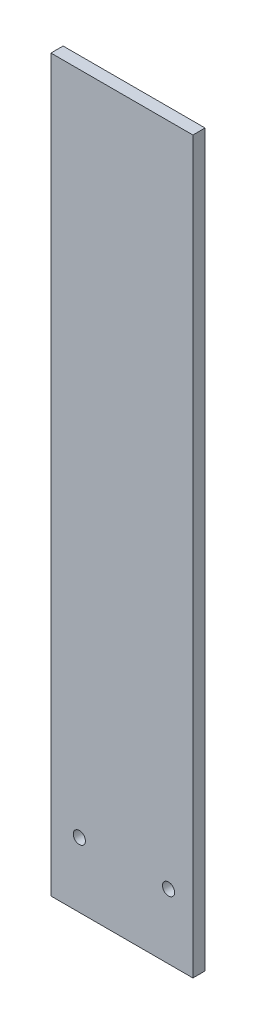
from build123d import *

# Parameters (mm, degrees)
CROQUIS2_W              = 35
CROQUIS2_H              = 180
CROQUIS2_R              = 1.5
SALIENTE_EXTRUIR1_DEPTH = 3


with BuildPart() as part:
    # Croquis2 → Saliente-Extruir1 (new body)
    with BuildSketch(Plane.XY):
        Rectangle(CROQUIS2_W, CROQUIS2_H)
        with Locations((11.5, -74)):
            Circle(CROQUIS2_R, mode=Mode.SUBTRACT)
        with Locations((-10.5, -74)):
            Circle(CROQUIS2_R, mode=Mode.SUBTRACT)
    extrude(amount=SALIENTE_EXTRUIR1_DEPTH)


solid = part.part
